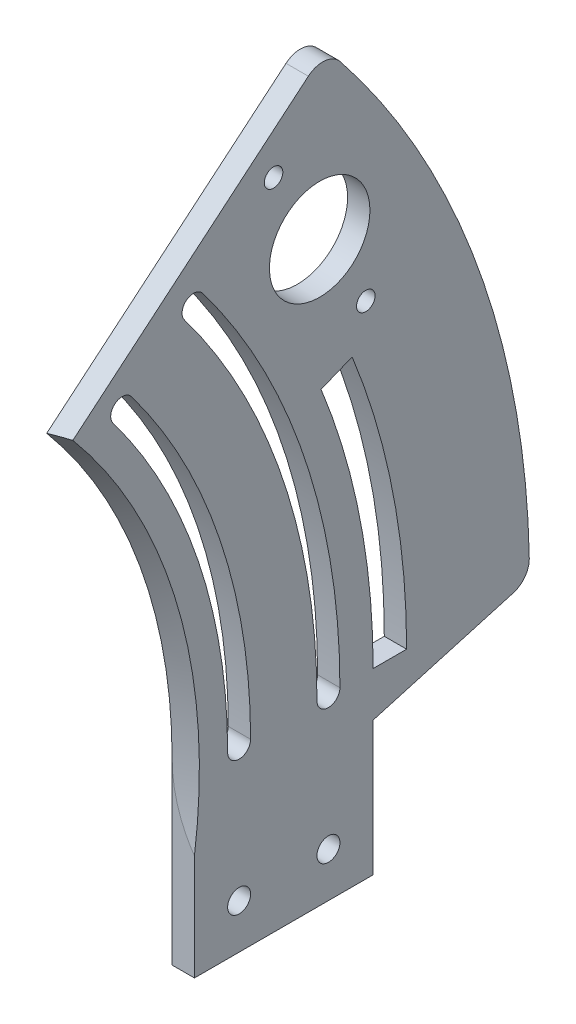
from build123d import *

# Parameters (mm, degrees)
SKETCH1_R           = 14.2875
SKETCH1_R_2         = 2.6289
BOSS_EXTRUDE1_DEPTH = 6.35
CUT_EXTRUDE4_DEPTH  = 6.35
SKETCH3_R           = 3.2639
CUT_EXTRUDE5_DEPTH  = 6.35
FILLET1_R           = 6.35
BOSS_EXTRUDE2_DEPTH = 6.35
FILLET3_R           = 6.35


with BuildPart() as part:
    # Sketch1 → Boss-Extrude1 (new body)
    with BuildSketch(Plane(origin=(0, 0, 0), x_dir=(0, 0, -1), z_dir=(1, 0, 0))):
        with BuildLine():
            Line((152.4, 0), (152.4, -50.8))
            Line((152.4, -50.8), (203.2, -50.8))
            Line((203.2, -50.8), (203.2, 0))
            ThreePointArc((203.2, 0), (200.112935412, 35.285309702), (190.945540544, 69.498493124))
            ThreePointArc((190.945540544, 69.498493124), (189.701046492, 72.826869766), (188.398540476, 76.132975421))
            Line((188.398540476, 76.132975421), (229.610721205, 92.787063794))
            ThreePointArc((229.610721205, 92.787063794), (212.273109896, 127.556455404), (189.710906338, 159.186351539))
            Line((189.710906338, 159.186351539), (155.660230842, 130.614442288))
            Line((155.660230842, 130.614442288), (116.745173131, 97.960831716))
            ThreePointArc((116.745173131, 97.960831716), (143.209155408, 52.123869843), (152.4, 0))
        make_face()
        with Locations((188.005902275, 113.300555851)):
            Circle(SKETCH1_R, mode=Mode.SUBTRACT)
        with Locations((174.895446842, 135.055462386)):
            Circle(SKETCH1_R_2, mode=Mode.SUBTRACT)
        with Locations((201.116357708, 91.545649316)):
            Circle(SKETCH1_R_2, mode=Mode.SUBTRACT)
    extrude(amount=BOSS_EXTRUDE1_DEPTH)

    # Sketch2 → Cut-Extrude4 (cut)
    with BuildSketch(Plane(origin=(6.35, 0, 0), x_dir=(0, 0, -1), z_dir=(1, 0, 0))):
        with BuildLine():
            ThreePointArc((134.46138915, 101.323924376), (129.890458655, 101.966326764), (129.248056268, 97.395396268))
            ThreePointArc((129.248056268, 97.395396268), (153.473001896, 51.351348104), (161.8361, 0))
            ThreePointArc((161.8361, 0), (165.1, -3.2639), (168.3639, 0))
            ThreePointArc((168.3639, 0), (159.663469053, 53.422649441), (134.46138915, 101.323924376))
        make_face()
        with BuildLine():
            ThreePointArc((154.746731105, 116.610025965), (150.17580061, 117.252428352), (149.533398223, 112.681497856))
            ThreePointArc((149.533398223, 112.681497856), (177.560422739, 59.410886377), (187.2361, 0))
            ThreePointArc((187.2361, 0), (190.5, -3.2639), (193.7639, 0))
            ThreePointArc((193.7639, 0), (183.750889895, 61.482187713), (154.746731105, 116.610025965))
        make_face()
    extrude(amount=-CUT_EXTRUDE4_DEPTH, mode=Mode.SUBTRACT)

    # Sketch3 → Cut-Extrude5 (cut)
    with BuildSketch(Plane(origin=(6.35, 0, 0), x_dir=(0, 0, -1), z_dir=(1, 0, 0))):
        with Locations((165.1, -38.1)):
            Circle(SKETCH3_R)
        with Locations((190.5, -38.1)):
            Circle(SKETCH3_R)
    extrude(amount=-CUT_EXTRUDE5_DEPTH, mode=Mode.SUBTRACT)

    # Fillet1
    fillet1_edges = [part.edges().sort_by_distance(p)[0] for p in [
        (3.175, 159.186351539, -189.710906338),
    ]]
    fillet(fillet1_edges, radius=FILLET1_R)

    # Sketch4 → Cut-Revolve1 (revolve, cut)
    with BuildSketch(Plane(origin=(0, 0, 0), x_dir=(1, 0, 0), z_dir=(0, 1, 0))):
        with BuildLine():
            Line((-89.242743252, 38.1), (146.392743252, 38.1))
            ThreePointArc((146.392743252, 38.1), (28.575, 155.917743252), (-89.242743252, 38.1))
        make_face()
    revolve(axis=Axis((-1000, 0, 0), (1, 0, 0)), mode=Mode.SUBTRACT)

    # Sketch5 → Boss-Extrude2 (add)
    with BuildSketch(Plane.ZY):
        with BuildLine():
            Line((-197.229722061, 79.701708643), (-229.610721205, 92.787063794))
            ThreePointArc((-229.610721205, 92.787063794), (-243.09835212, 47.262180406), (-247.65, 0))
            Line((-247.65, 0), (-203.2, -12.7))
            Line((-203.2, -12.7), (-203.2, 0))
            Line((-203.2, 0), (-212.725, 0))
            ThreePointArc((-212.725, 0), (-208.81525118, 40.597001118), (-197.229722061, 79.701708643))
        make_face()
    extrude(amount=-BOSS_EXTRUDE2_DEPTH)

    # Fillet3
    fillet3_edges = [part.edges().sort_by_distance(p)[0] for p in [
        (3.175, 0, -247.65),
    ]]
    fillet(fillet3_edges, radius=FILLET3_R)


solid = part.part
